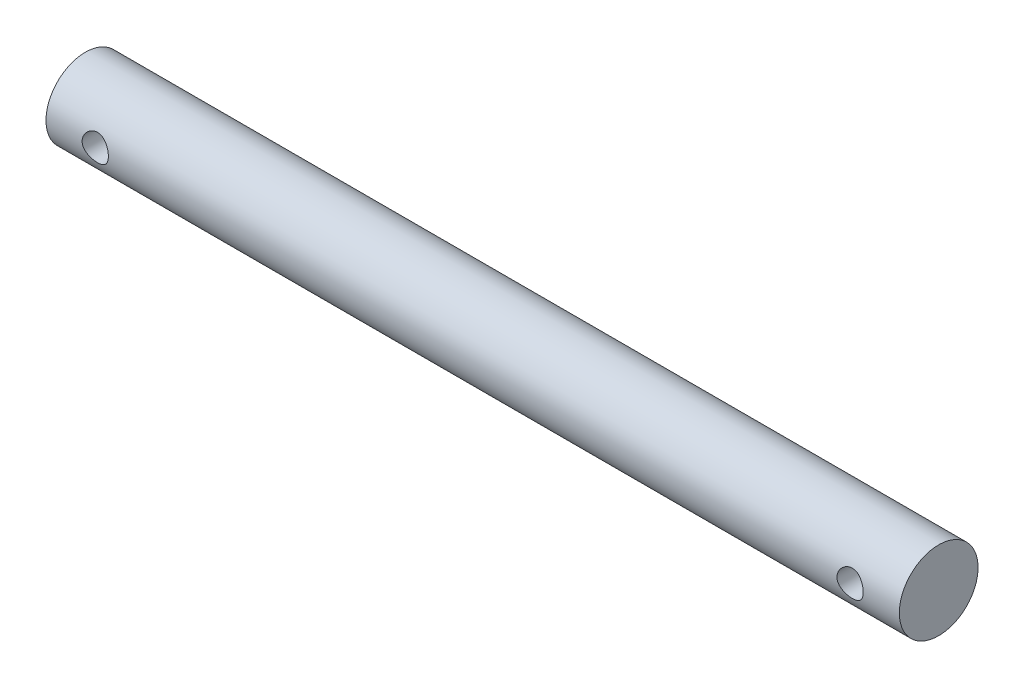
from build123d import *

# Parameters (mm, degrees)
SKETCH1_W               = 130
SKETCH1_H               = 6
CUT_EXTRUDE6_DEPTH      = 131.276628756
CUT_EXTRUDE6_DEPTH_BACK = 131.276628756
SKETCH2_R               = 2
CUT_EXTRUDE7_DEPTH      = 131.276628865
CUT_EXTRUDE7_DEPTH_BACK = 131.276628865
SKETCH2_7_R             = 2


with BuildPart() as part:
    # Sketch1 → Revolve1 (revolve)
    with BuildSketch(Plane.XY):
        with Locations((65, 3)):
            Rectangle(SKETCH1_W, SKETCH1_H)
    revolve(axis=Axis((0, 0, 0), (1, 0, 0)))

    # Sketch2 → Cut-Extrude6 (cut, two sides: drawn at the far end of the back side and taken through both)
    with BuildSketch(Plane.XY.offset(-CUT_EXTRUDE6_DEPTH_BACK)):
        with Locations((7.5, 0)):
            Circle(SKETCH2_R)
    extrude(amount=CUT_EXTRUDE6_DEPTH + CUT_EXTRUDE6_DEPTH_BACK, mode=Mode.SUBTRACT)

    # Sketch2<7> → Cut-Extrude7 (cut, two sides: drawn at the far end of the back side and taken through both)
    with BuildSketch(Plane.XY.offset(-CUT_EXTRUDE7_DEPTH_BACK)):
        with Locations((122.5, 0)):
            Circle(SKETCH2_7_R)
    extrude(amount=CUT_EXTRUDE7_DEPTH + CUT_EXTRUDE7_DEPTH_BACK, mode=Mode.SUBTRACT)


solid = part.part
